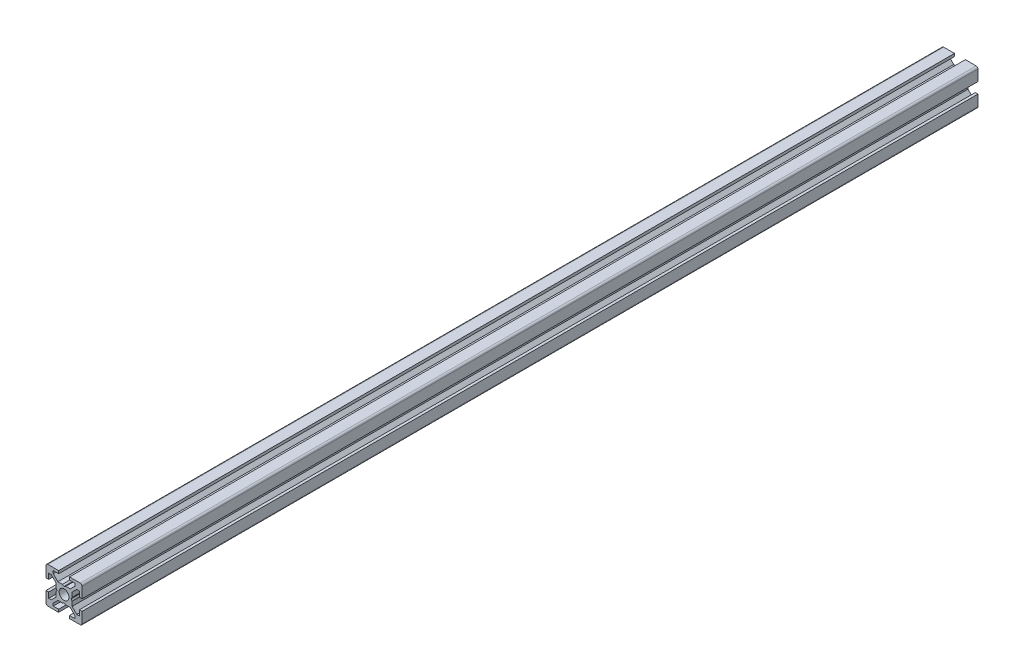
from build123d import *

# Parameters (mm, degrees)
SKETCH1_R           = 2.75
BOSS_EXTRUDE1_DEPTH = 496
FILLET2_R           = 1
FILLET3_R           = 1
FILLET4_R           = 1
FILLET5_R           = 1


with BuildPart() as part:
    # Sketch1 → Boss-Extrude1 (new body)
    with BuildSketch(Plane.XY):
        Polygon((-3.001792446, 10), (-10, 10), (-10, 3.001792446), (-8.500771543, 3.001792446), (-8.500771543, 6.014407427), (-7.045753692, 6.014407427), (-4.458187435, 3.426841169), (-4.458187435, 0.939646666), (-3.934715846, 0), (-4.45749106, -0.939646666), (-4.458187435, -3.426841169), (-7.045753692, -6.014407427), (-8.500771543, -6.014407427), (-8.500771543, -3.001792446), (-10, -3.001792446), (-10, -10), (-3.001792446, -10), (-3.001792446, -8.499999951), (-6.014791508, -8.499999951), (-6.014791508, -7.045753643), (-3.427225251, -4.458187385), (-0.939604714, -4.458187385), (-0.00108721, -3.933944043), (0.937618184, -4.457850876), (3.425238721, -4.457850876), (6.012804978, -7.045417133), (6.012804978, -8.499999951), (3.001792545, -8.499999951), (3.001792545, -10), (10.000000099, -10), (10.000000099, -3.001792446), (8.500000007, -3.001792446), (8.500000007, -6.014262022), (7.045447383, -6.014262022), (4.458345013, -3.426231961), (4.458790942, -0.938611464), (3.934715846, 0), (4.45749106, 0.939646666), (4.458344956, 3.426231961), (7.045447327, 6.014262022), (8.500000148, 6.014262022), (8.500000148, 3.001792446), (10.000000198, 3.001792446), (10.000000198, 10), (3.001792643, 10), (3.001792643, 8.499999951), (6.012804978, 8.499999951), (6.012804978, 7.045417133), (3.425238721, 4.457850876), (0.937618184, 4.457850876), (-0.00108721, 3.933944043), (-0.939604714, 4.458187385), (-3.427225251, 4.458187385), (-6.014791508, 7.045753643), (-6.014791508, 8.499999951), (-3.001792446, 8.499999951), align=None)
        Circle(SKETCH1_R, mode=Mode.SUBTRACT)
    extrude(amount=BOSS_EXTRUDE1_DEPTH)

    # Fillet2
    fillet2_edges = [part.edges().sort_by_distance(p)[0] for p in [
        (-10, -10, 248),
    ]]
    fillet(fillet2_edges, radius=FILLET2_R)

    # Fillet3
    fillet3_edges = [part.edges().sort_by_distance(p)[0] for p in [
        (10.000000099, -10, 248),
    ]]
    fillet(fillet3_edges, radius=FILLET3_R)

    # Fillet4
    fillet4_edges = [part.edges().sort_by_distance(p)[0] for p in [
        (-10, 10, 248),
    ]]
    fillet(fillet4_edges, radius=FILLET4_R)

    # Fillet5
    fillet5_edges = [part.edges().sort_by_distance(p)[0] for p in [
        (10.000000198, 10, 248),
    ]]
    fillet(fillet5_edges, radius=FILLET5_R)


solid = part.part
